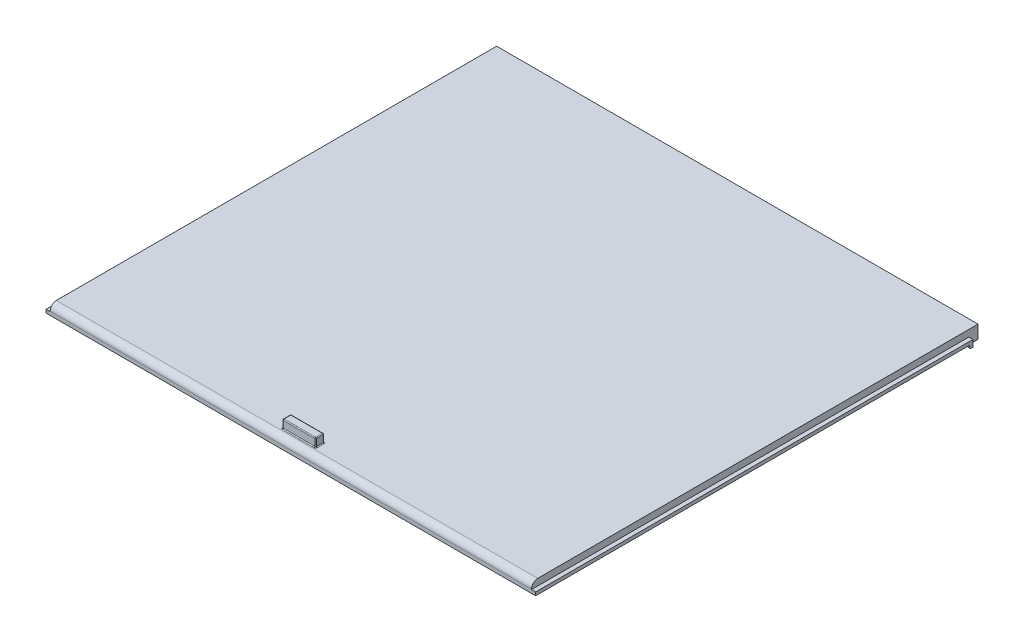
from build123d import *

# Parameters (mm, degrees)
BOSS_EXTRUDE1_DEPTH  = 29.5
BOSS_EXTRUDE2_DEPTH  = 29
SKETCH7_W            = 1
SKETCH7_H            = 1
BOSS_EXTRUDE3_DEPTH  = 2
FILLET1_R            = 0.75
FILLET2_R            = 0.2
FILLET1_OF_MIRROR1_R = 0.75
FILLET2_OF_MIRROR1_R = 0.2
FILLET3_R            = 0.1


with BuildPart() as part:
    # Sketch1 → Boss-Extrude1 (new body)
    with BuildSketch(Plane(origin=(0, 0, 0), x_dir=(0, 0, -1), z_dir=(1, 0, 0))):
        Polygon((0, 0), (0, 0.4), (52.7, 0.4), (52.7, -0.4), (52.284313725, -0.4), (52.284313725, 0), align=None)
    boss_extrude1 = extrude(amount=BOSS_EXTRUDE1_DEPTH)

    # Sketch5 → Boss-Extrude2 (add)
    with BuildSketch(Plane(origin=(29.5, 0, -29.5), x_dir=(0, 0, 1), z_dir=(-1, 0, 0))):
        Polygon((29.5, 0.4), (-23.2, 0.4), (-23.2, -0.4), (-24.3, -0.4), (-24.3, 1.2), (29.5, 1.2), align=None)
    boss_extrude2 = extrude(amount=BOSS_EXTRUDE2_DEPTH)

    # Fillet1
    fillet1_edges = [part.edges().sort_by_distance(p)[0] for p in [
        (15, 1.2, 0),
    ]]
    fillet(fillet1_edges, radius=FILLET1_R)

    # Fillet2
    fillet2_edges = [part.edges().sort_by_distance(p)[0] for p in [
        (14.75, -0.4, -52.284313725),
    ]]
    fillet(fillet2_edges, radius=FILLET2_R)


with BuildPart() as body_2:
    # Sketch7 → Boss-Extrude3 (new body)
    with BuildSketch(Plane(origin=(29.5, 0, 0), x_dir=(0, 0, -1), z_dir=(1, 0, 0))):
        with Locations((1.496141384, 1.7)):
            Rectangle(SKETCH7_W, SKETCH7_H)
    boss_extrude3 = extrude(amount=-BOSS_EXTRUDE3_DEPTH)


with BuildPart() as part_1:
    add(part.part)

    add(body_2.part)  # Mirror1 merges body 2
    # Mirror1: Boss-Extrude1, Boss-Extrude2, Boss-Extrude3 across plane
    add(boss_extrude1.mirror(Plane.ZY.offset(-29.5)))
    add(boss_extrude2.mirror(Plane.ZY.offset(-29.5)))
    add(boss_extrude3.mirror(Plane.ZY.offset(-29.5)))

    # Fillet1 of Mirror1
    fillet1_of_mirror1_edges = [part_1.edges().sort_by_distance(p)[0] for p in [
        (44, 1.2, 0),
    ]]
    fillet(fillet1_of_mirror1_edges, radius=FILLET1_OF_MIRROR1_R)

    # Fillet2 of Mirror1
    fillet2_of_mirror1_edges = [part_1.edges().sort_by_distance(p)[0] for p in [
        (44.25, -0.4, -52.284313725),
    ]]
    fillet(fillet2_of_mirror1_edges, radius=FILLET2_OF_MIRROR1_R)

    # Fillet3
    fillet3_edges = [part_1.edges().sort_by_distance(p)[0] for p in [
        (29.5, 1.2, -0.996141384),
        (29.5, 2.2, -0.996141384),
        (29.5, 2.2, -1.996141384),
        (29.5, 1.2, -1.996141384),
        (31.5, 1.2, -1.496141384),
        (31.5, 1.7, -1.996141384),
        (31.5, 2.2, -1.496141384),
        (31.5, 1.7, -0.996141384),
        (27.5, 1.2, -1.496141384),
        (27.5, 1.7, -0.996141384),
        (27.5, 2.2, -1.496141384),
        (27.5, 1.7, -1.996141384),
    ]]
    fillet(fillet3_edges, radius=FILLET3_R)


solid = part_1.part
